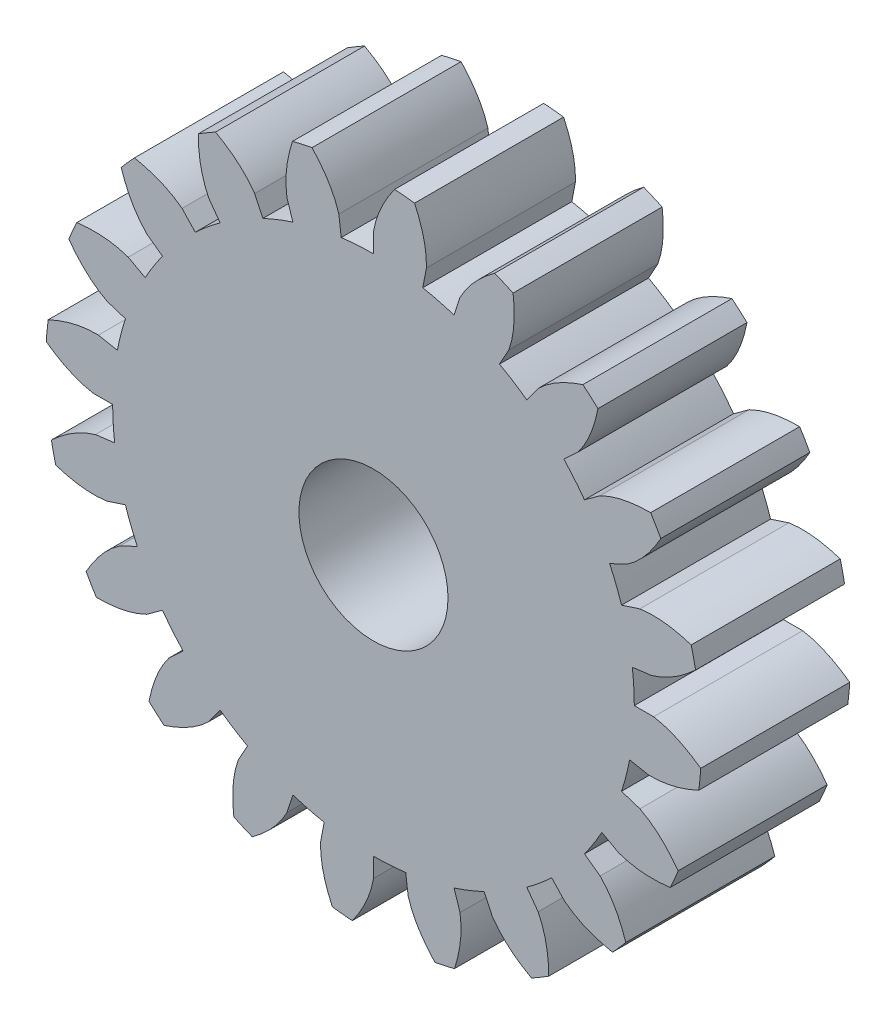
from build123d import *

# Parameters (mm, degrees)
SKETCH1_R           = 5
BOSS_EXTRUDE1_DEPTH = 10
CIRPATTERN1_COUNT   = 20


with BuildPart() as part:
    # Sketch1 → Boss-Extrude1 (new body)
    with BuildSketch(Plane.XY):
        with BuildLine():
            add(Edge.make_bspline(
                [(0, 18.794), (0.189855818, 19.9502964), (0.72967925, 21.003216662), (1.417395776, 21.954293184)],
                knots=[0, 0, 0, 0, 0.207530091, 0.207530091, 0.207530091, 0.207530091], degree=3))
            Line((0, 18.794), (0, 17.5))
            ThreePointArc((0, 17.5), (-1.661085566, -17.420987192), (3.307171471, 17.184662256))
            Line((3.307171471, 17.184662256), (3.551713179, 18.455345282))
            add(Edge.make_bspline(
                [(3.551713179, 18.455345282), (3.583796742, 19.626685217), (3.252682713, 20.762649088), (2.757093966, 21.826553389)],
                knots=[0, 0, 0, 0, 0.207530091, 0.207530091, 0.207530091, 0.207530091], degree=3))
            ThreePointArc((2.757093966, 21.826553389), (2.088221855, 21.900669613), (1.417395776, 21.954293184))
        make_face()
        Circle(SKETCH1_R, mode=Mode.SUBTRACT)
    boss_extrude1 = extrude(amount=BOSS_EXTRUDE1_DEPTH)

    # CirPattern1: Boss-Extrude1 ×20 about axis
    cirpattern1_axis = Axis((0, 0, 0), (0, 0, -1))
    for i in range(1, CIRPATTERN1_COUNT):
        add(boss_extrude1.rotate(cirpattern1_axis, i * 360 / CIRPATTERN1_COUNT))


solid = part.part
